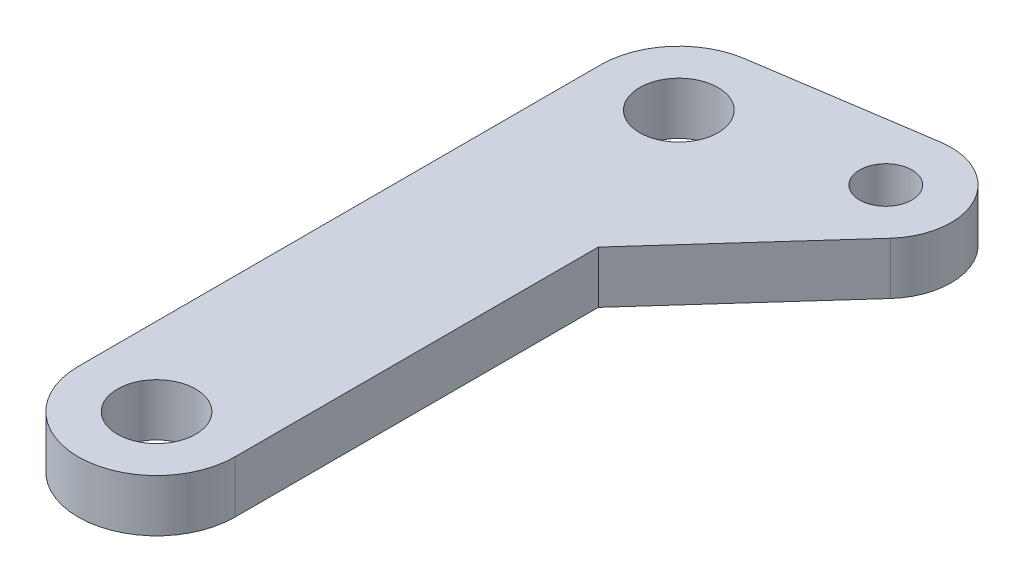
from build123d import *

# Parameters (mm, degrees)
SKETCH1_R           = 1.5
BOSS_EXTRUDE1_DEPTH = 2
BOSS_EXTRUDE2_START = -2
SKETCH2_R           = 1
BOSS_EXTRUDE2_DEPTH = 2


with BuildPart() as part:
    # Sketch1 → Boss-Extrude1 (new body)
    with BuildSketch(Plane(origin=(0, 0, 0), x_dir=(1, 0, 0), z_dir=(0, 1, 0))):
        with BuildLine():
            Line((3, 0), (3, 20))
            ThreePointArc((3, 20), (0, 23), (-3, 20))
            Line((-3, 20), (-3, 0))
            ThreePointArc((-3, 0), (0, -3), (3, 0))
        make_face()
        with Locations(Location((0, 0, 0), (0, 0, 270))):
            Circle(SKETCH1_R, mode=Mode.SUBTRACT)
        with Locations(Location((0, 20, 0), (0, 0, 270))):
            Circle(SKETCH1_R, mode=Mode.SUBTRACT)
    extrude(amount=BOSS_EXTRUDE1_DEPTH)

    # Sketch2 → Boss-Extrude2 (add)
    with BuildSketch(Plane(origin=(0, 2, 0), x_dir=(1, 0, 0), z_dir=(0, 1, 0)).offset(BOSS_EXTRUDE2_START)):
        with BuildLine():
            Line((8.303850429, 19.807351686), (3, 13.914475038))
            Line((3, 13.914475038), (3, 20))
            ThreePointArc((3, 20), (1.956412946, 22.274301735), (-0.448298923, 22.966315573))
            Line((-0.448298923, 22.966315573), (6.072073621, 23.951738706))
            ThreePointArc((6.072073621, 23.951738706), (8.646793057, 22.665134295), (8.303850429, 19.807351686))
        make_face()
        with Locations(Location((6.445656057, 21.479809062, 0), (0, 0, 270))):
            Circle(SKETCH2_R, mode=Mode.SUBTRACT)
    extrude(amount=BOSS_EXTRUDE2_DEPTH)


solid = part.part
